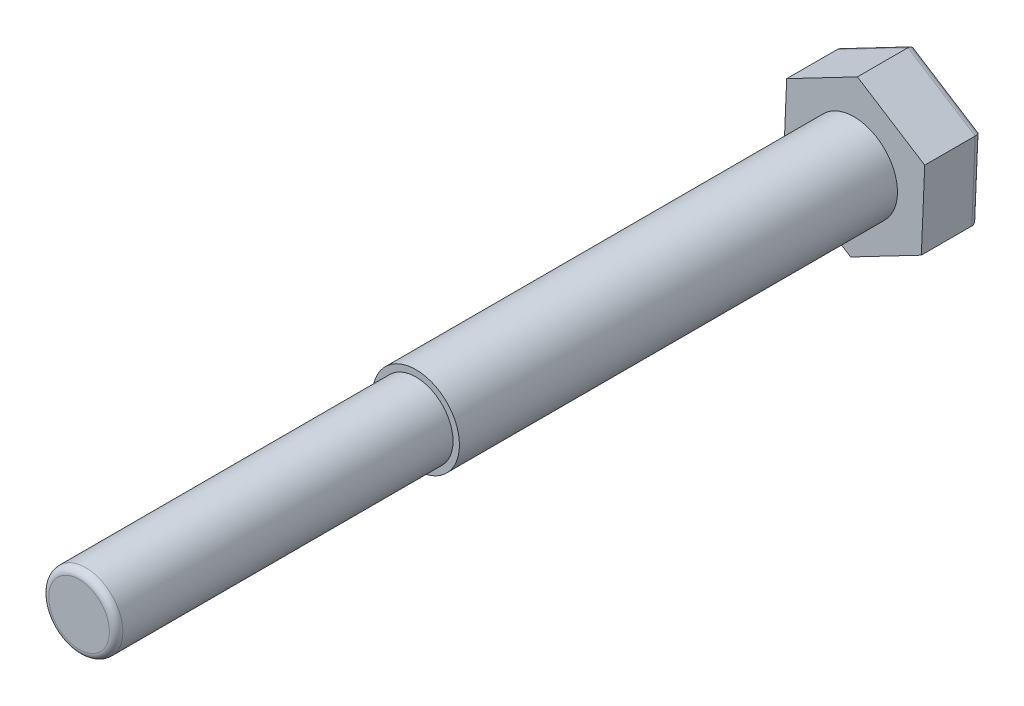
from build123d import *

# Parameters (mm, degrees)
EXTRUDE_275_DEPTH = 17
SKETCH_2_R        = 12.9
EXTRUDE_1_DEPTH   = 130
FILLET_3_R        = 2
SKETCH_3_R        = 11
EXTRUDE_2_DEPTH   = 100
FILLET_4_R        = 2


with BuildPart() as part:
    # 草图1 → Extrude 275 (new body)
    with BuildSketch(Plane.XY):
        Polygon((20.984201837, 10.954296262), (1.005402075, 23.65), (-19.978799762, 12.695703738), (-20.984201837, -10.954296262), (-1.005402075, -23.65), (19.978799762, -12.695703738), align=None)
    extrude(amount=EXTRUDE_275_DEPTH)

    # 草图2 → 凸台-拉伸1 (add)
    with BuildSketch(Plane.XY.offset(17)):
        with Locations(Location((0, 0, 0), (0, 0, 180))):
            Circle(SKETCH_2_R)
    extrude(amount=EXTRUDE_1_DEPTH)

    # 圆角3
    fillet_3_edges = [part.edges().sort_by_distance(p)[0] for p in [
        (9.486698843, -18.172851869, 0),
        (-10.994801956, -17.302148131, 0),
        (-20.4815008, 0.870703738, 0),
        (-9.486698843, 18.172851869, 0),
        (10.994801956, 17.302148131, 0),
        (20.4815008, -0.870703738, 0),
    ]]
    fillet(fillet_3_edges, radius=FILLET_3_R)

    # 草图3 → 凸台-拉伸2 (add)
    with BuildSketch(Plane.XY.offset(147)):
        Circle(SKETCH_3_R)
    extrude(amount=EXTRUDE_2_DEPTH)

    # 圆角4
    fillet_4_edges = [part.edges().sort_by_distance(p)[0] for p in [
        (-11, 0, 247),
    ]]
    fillet(fillet_4_edges, radius=FILLET_4_R)


solid = part.part
